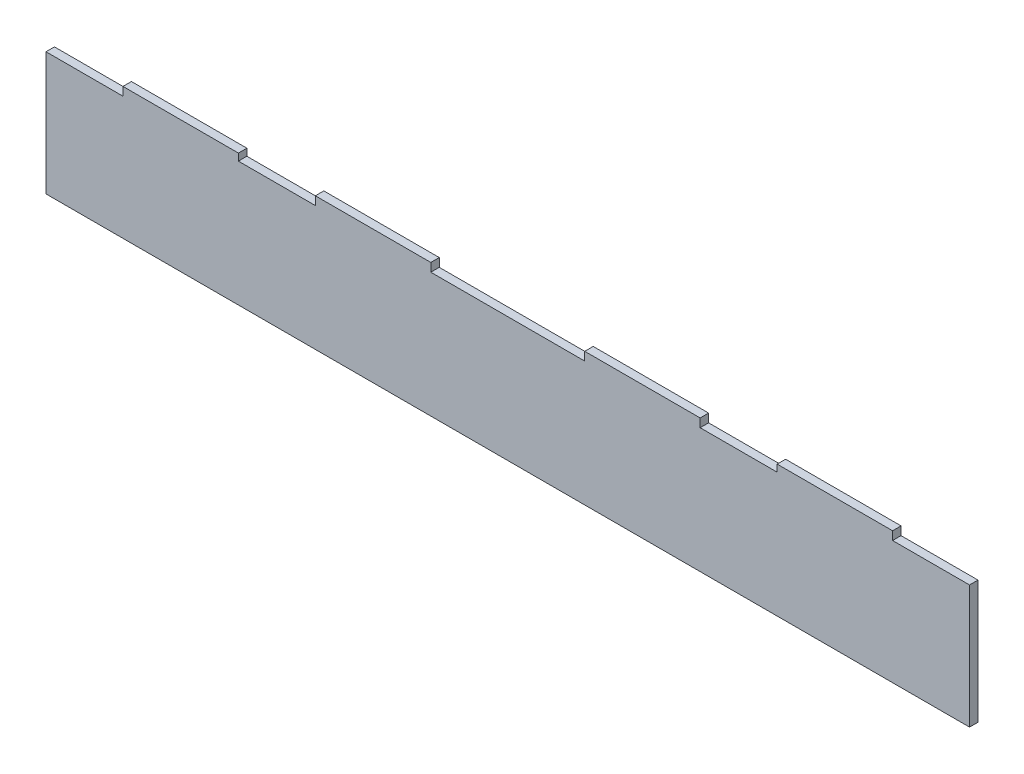
from build123d import *

# Parameters (mm, degrees)
BOSS_EXTRUDE1_DEPTH = 5.588


with BuildPart() as part:
    # Sketch1 → Boss-Extrude1 (new body)
    with BuildSketch(Plane.XY):
        Polygon((-117.866009852, 69.851251232), (-41.666009852, 69.851251232), (-41.666009852, 65.240100289), (9.133990148, 65.240100289), (9.133990148, 70.828100289), (85.333990148, 70.828100289), (85.333990148, 65.240100289), (186.933990148, 65.240100289), (186.933990148, 70.828100289), (263.133990148, 70.828100289), (263.133990148, 65.240100289), (313.933990148, 65.240100289), (313.933990148, 69.851251232), (390.133990148, 69.851251232), (390.133990148, 64.263251232), (440.933990148, 64.263251232), (440.933990148, -17.016748768), (-168.666009852, -17.016748768), (-168.666009852, 64.263251232), (-117.866009852, 64.263251232), align=None)
    extrude(amount=BOSS_EXTRUDE1_DEPTH)


solid = part.part
